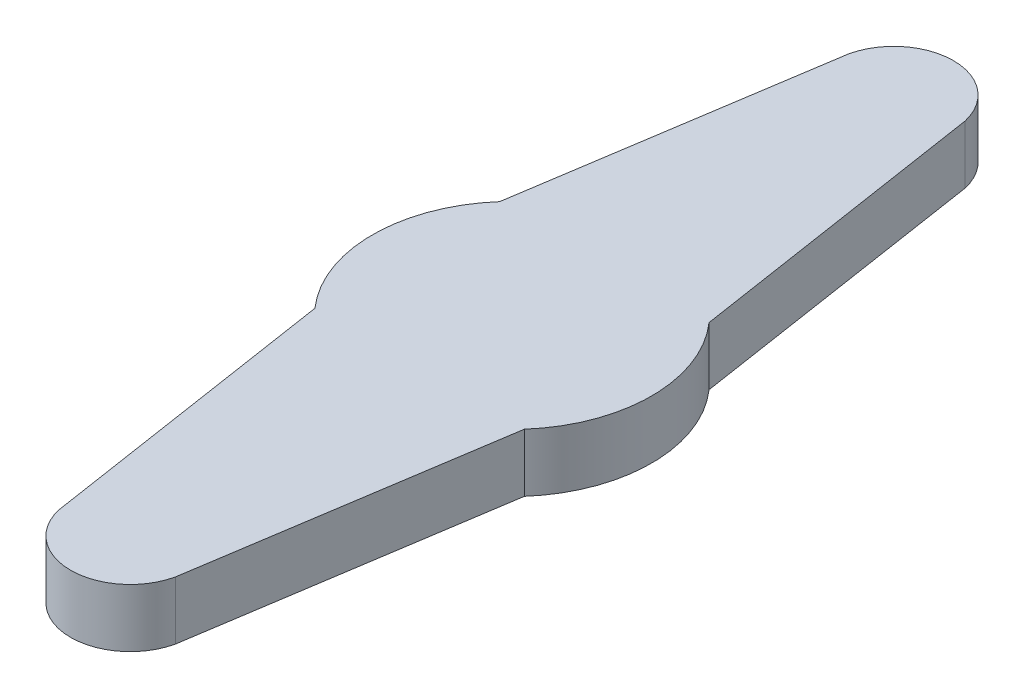
from build123d import *

# Parameters (mm, degrees)
BOSS_EXTRUDE1_DEPTH = 2.5


with BuildPart() as part:
    # Sketch1 → Boss-Extrude1 (new body)
    with BuildSketch(Plane(origin=(0, 0, 0), x_dir=(1, 0, 0), z_dir=(0, 1, 0))):
        with BuildLine():
            Line((-2.5, 16.968626967), (-4.5, 3.968626967))
            ThreePointArc((-4.5, 3.968626967), (-6, 0), (-4.5, -3.968626967))
            Line((-4.5, -3.968626967), (-2.5, -16.968626967))
            ThreePointArc((-2.5, -16.968626967), (0, -18.968626967), (2.5, -16.968626967))
            Line((2.5, -16.968626967), (4.5, -3.968626967))
            ThreePointArc((4.5, -3.968626967), (6, 0), (4.5, 3.968626967))
            Line((4.5, 3.968626967), (2.5, 16.968626967))
            ThreePointArc((2.5, 16.968626967), (0, 18.968626967), (-2.5, 16.968626967))
        make_face()
    extrude(amount=BOSS_EXTRUDE1_DEPTH)


solid = part.part
